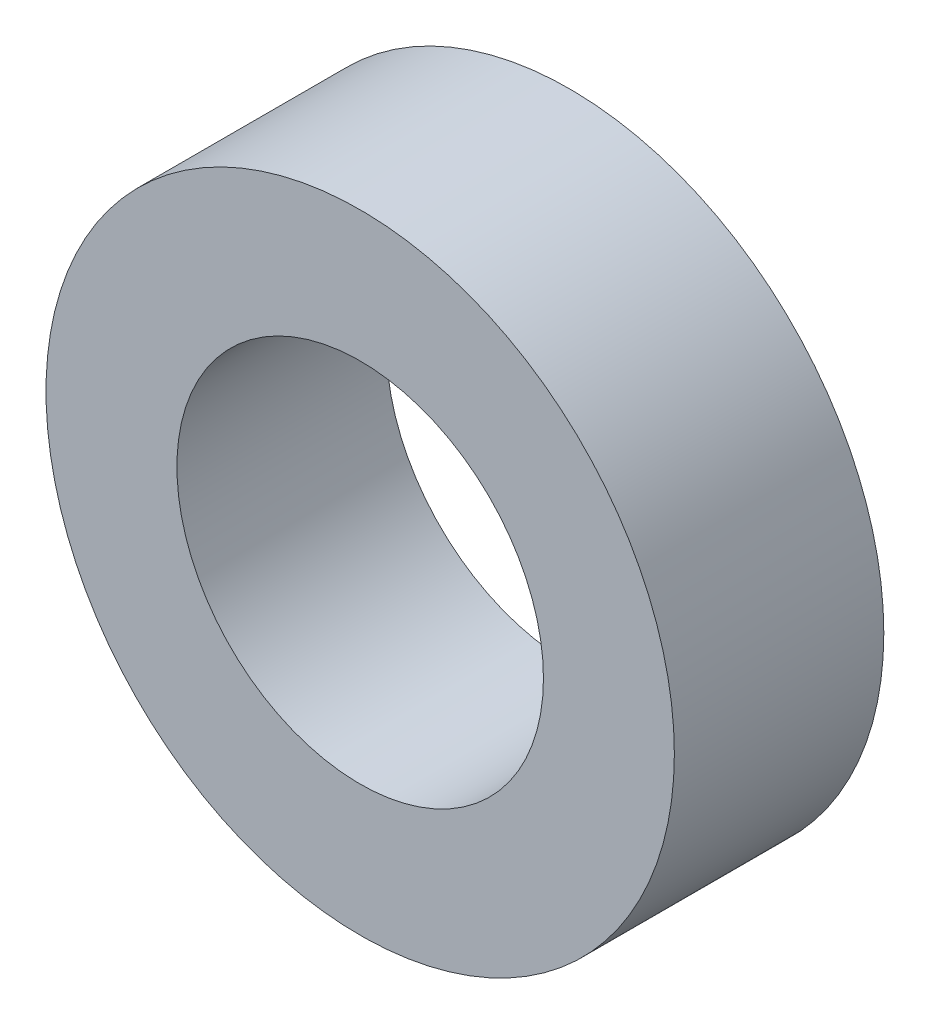
from build123d import *

# Parameters (mm, degrees)
SKETCH_1_R      = 3
SKETCH_1_R_2    = 1.75
EXTRUDE_1_DEPTH = 2


with BuildPart() as part:
    # Эскиз1 → Бобышка-Вытянуть1 (new body)
    with BuildSketch(Plane.XY):
        Circle(SKETCH_1_R)
        Circle(SKETCH_1_R_2, mode=Mode.SUBTRACT)
    extrude(amount=EXTRUDE_1_DEPTH)


solid = part.part
